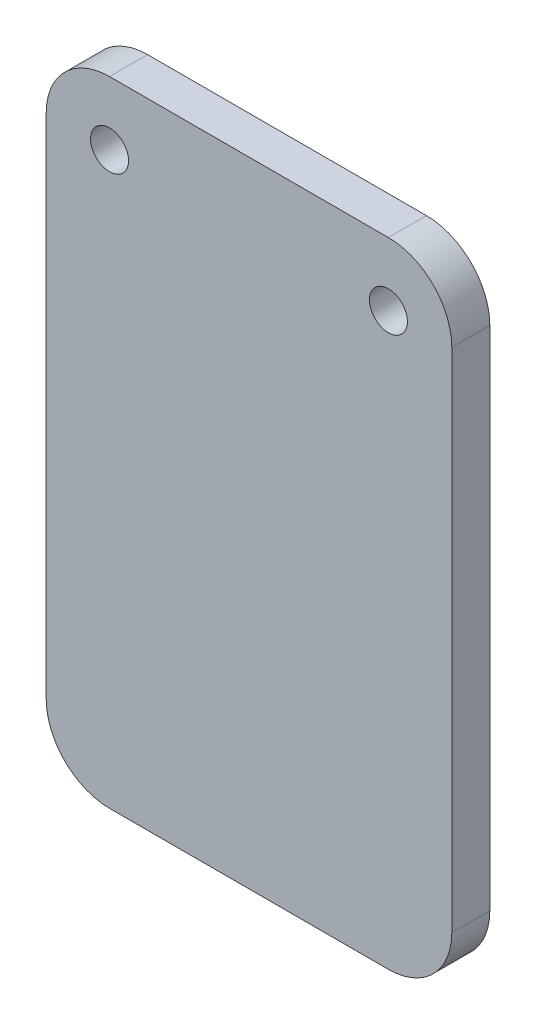
from build123d import *

# Parameters (mm, degrees)
SKETCH1_R           = 1.5
BOSS_EXTRUDE1_DEPTH = 3


with BuildPart() as part:
    # Sketch1 → Boss-Extrude1 (new body)
    with BuildSketch(Plane.XY):
        with BuildLine():
            Line((5, 0), (27, 0))
            ThreePointArc((27, 0), (30.535533906, 1.464466094), (32, 5))
            Line((32, 5), (32, 45))
            ThreePointArc((32, 45), (30.535533906, 48.535533906), (27, 50))
            Line((27, 50), (5, 50))
            ThreePointArc((5, 50), (1.464466094, 48.535533906), (0, 45))
            Line((0, 45), (0, 5))
            ThreePointArc((0, 5), (1.464466094, 1.464466094), (5, 0))
        make_face()
        with Locations((5, 45)):
            Circle(SKETCH1_R, mode=Mode.SUBTRACT)
        with Locations(Location((27, 45, 0), (0, 0, 180))):
            Circle(SKETCH1_R, mode=Mode.SUBTRACT)
    extrude(amount=BOSS_EXTRUDE1_DEPTH)


solid = part.part
